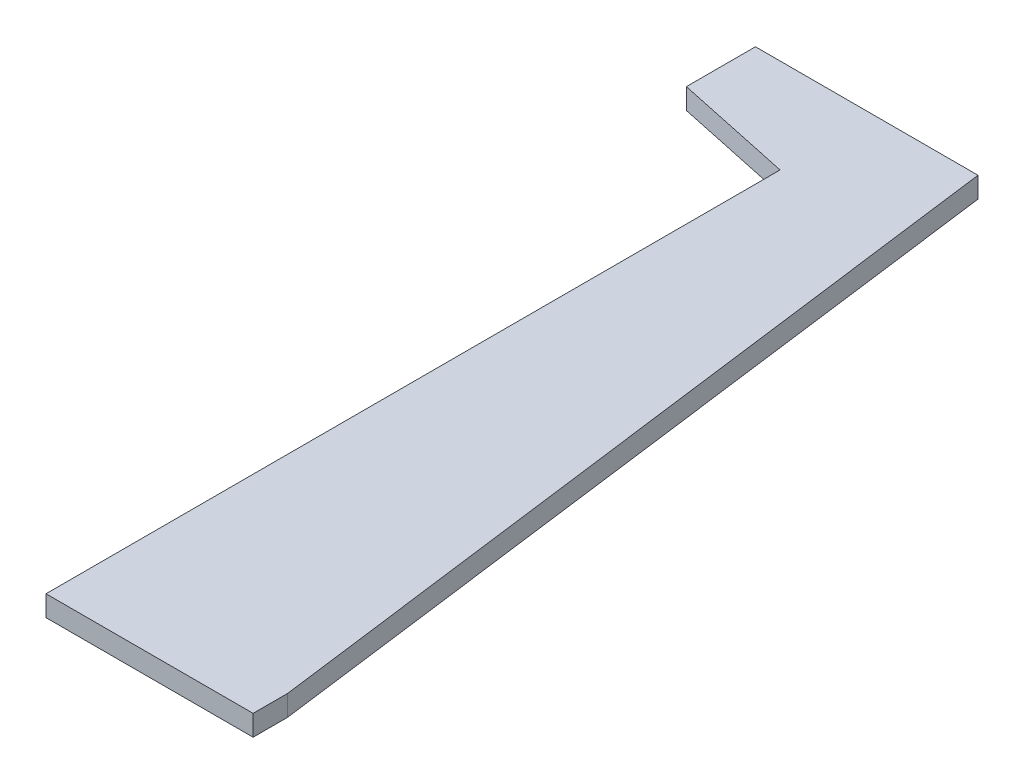
from build123d import *

# Parameters (mm, degrees)
EXTRUDE_1_DEPTH = 3


with BuildPart() as part:
    # Эскиз1 → Бобышка-Вытянуть1 (new body)
    with BuildSketch(Plane(origin=(0, 0, 0), x_dir=(1, 0, 0), z_dir=(0, 1, 0))):
        Polygon((0, 0), (0, 106.33035752), (-17.23666696, 110), (-17.23666696, 120), (0, 120), (15, 120), (30, 5), (30, 0), align=None)
    extrude(amount=EXTRUDE_1_DEPTH)


solid = part.part
